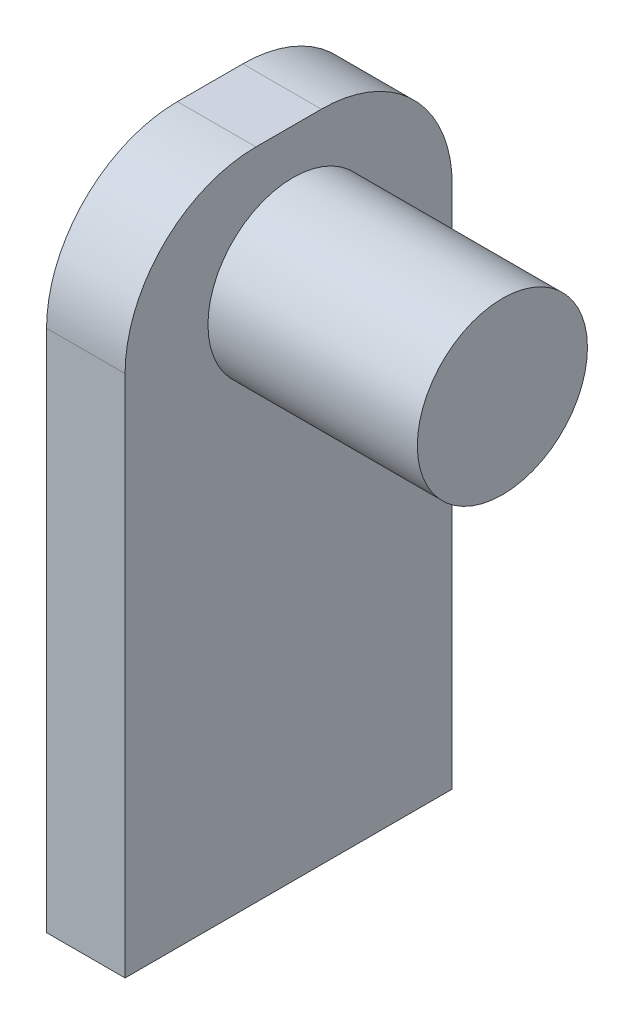
from build123d import *

# Parameters (mm, degrees)
BOSS_EXTRUDE1_DEPTH = 6
SKETCH2_R           = 6.5
BOSS_EXTRUDE2_DEPTH = 16
SKETCH3_R           = 2.409375482
CUT_EXTRUDE1_DEPTH  = 2.5


with BuildPart() as part:
    # Sketch1 → Boss-Extrude1 (new body)
    with BuildSketch(Plane(origin=(0, 0, 0), x_dir=(0, 0, -1), z_dir=(1, 0, 0))):
        with BuildLine():
            Line((-10, 0), (-15, 0))
            ThreePointArc((-15, 0), (-22.071067812, -2.928932188), (-25, -10))
            Line((-25, -10), (-25, -50))
            Line((-25, -50), (0, -50))
            Line((0, -50), (0, -10))
            ThreePointArc((0, -10), (-2.928932188, -2.928932188), (-10, 0))
        make_face()
    extrude(amount=BOSS_EXTRUDE1_DEPTH)

    # Sketch2 → Boss-Extrude2 (add)
    with BuildSketch(Plane(origin=(6, 0, 0), x_dir=(0, 0, -1), z_dir=(1, 0, 0))):
        with Locations(Location((-12.165364516, -9.941403235, 0), (0, 0, 180))):
            Circle(SKETCH2_R)
    extrude(amount=BOSS_EXTRUDE2_DEPTH)

    # Sketch3 → Cut-Extrude1 (cut)
    with BuildSketch(Plane.ZY):
        with Locations((12.90156258, -42.802607731)):
            Circle(SKETCH3_R)
    extrude(amount=-CUT_EXTRUDE1_DEPTH, mode=Mode.SUBTRACT)


solid = part.part
